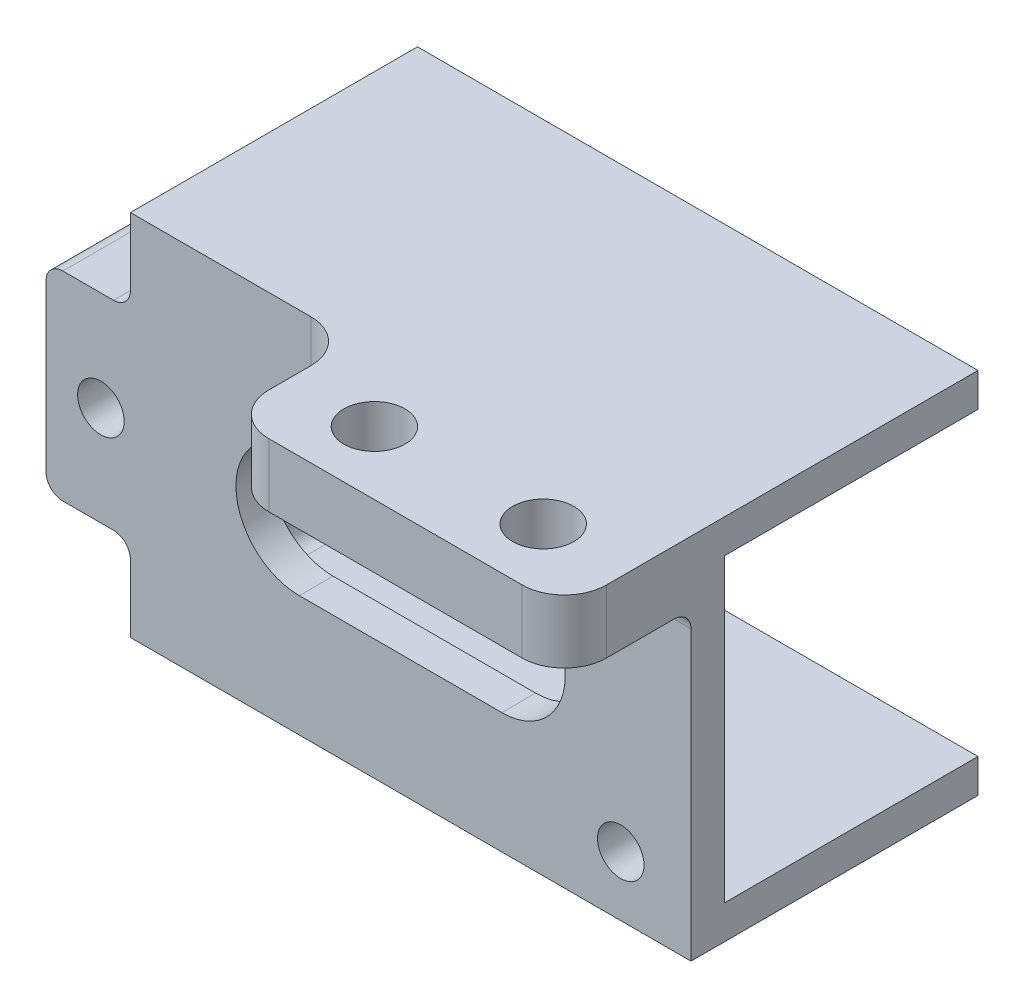
from build123d import *

# Parameters (mm, degrees)
BOSS_EXTRUDE1_DEPTH     = 19.05
SKETCH2_W               = 42.164
SKETCH2_H               = 27.686
BOSS_EXTRUDE2_DEPTH     = 2.54
SKETCH3_W               = 7.0612
SKETCH3_H               = 14.986
BOSS_EXTRUDE3_DEPTH     = 6.35
CUT_EXTRUDE1_DEPTH      = 50.127067096
CUT_EXTRUDE1_DEPTH_BACK = 50.127067096
SKETCH4_R               = 1.75
FILLET2_R               = 1.27
CUT_EXTRUDE2_DEPTH      = 52.65763053
CUT_EXTRUDE2_DEPTH_BACK = 52.65763053
SKETCH5_R               = 4.7625
SKETCH6_W               = 25.4
SKETCH6_H               = 4.7625
BOSS_EXTRUDE4_DEPTH     = 9.525
FILLET3_R               = 3.175
FILLET4_R               = 1.27
FILLET6_R               = 1.27
CUT_EXTRUDE3_DEPTH      = 58.486687197
CUT_EXTRUDE3_DEPTH_BACK = 58.486687197
SKETCH8_R               = 2.3
SKETCH9_W               = 2.54
SKETCH9_H               = 10.16
CUT_EXTRUDE4_DEPTH      = 14.5288
CUT_EXTRUDE5_DEPTH      = 51.648644651
CUT_EXTRUDE5_DEPTH_BACK = 51.648644651
SKETCH10_R              = 1.7499965


with BuildPart() as part:
    # Sketch1 → Boss-Extrude1 (new body)
    with BuildSketch(Plane.XY):
        Polygon((-2.54, 25.146), (39.624, 25.146), (39.624, 22.606), (37.084, 22.606), (0, 22.606), (0, 0), (37.084, 0), (39.624, 0), (39.624, -2.54), (-2.54, -2.54), align=None)
    extrude(amount=BOSS_EXTRUDE1_DEPTH)

    # Sketch2 → Boss-Extrude2 (add)
    with BuildSketch(Plane.XY.offset(19.05)):
        with Locations((18.542, 11.303)):
            Rectangle(SKETCH2_W, SKETCH2_H)
    extrude(amount=BOSS_EXTRUDE2_DEPTH)

    # Sketch3 → Boss-Extrude3 (add)
    with BuildSketch(Plane.ZY.offset(2.54)):
        with Locations((18.0594, 11.303)):
            Rectangle(SKETCH3_W, SKETCH3_H)
    extrude(amount=BOSS_EXTRUDE3_DEPTH)

    # Sketch4 → Cut-Extrude1 (cut, two sides: drawn at the far end of the back side and taken through both)
    with BuildSketch(Plane(origin=(0, 0, 14.5288), x_dir=(-1, 0, 0), z_dir=(0, 0, -1)).offset(-CUT_EXTRUDE1_DEPTH_BACK)):
        with Locations(Location((4.7625, 11.303, 0), (0, 0, 90))):
            Circle(SKETCH4_R)
    extrude(amount=CUT_EXTRUDE1_DEPTH + CUT_EXTRUDE1_DEPTH_BACK, mode=Mode.SUBTRACT)

    # Fillet2
    fillet2_edges = [part.edges().sort_by_distance(p)[0] for p in [
        (-2.54, 18.796, 18.0594),
        (-2.54, 3.81, 18.0594),
        (-8.89, 18.796, 18.0594),
        (-8.89, 3.81, 18.0594),
    ]]
    fillet(fillet2_edges, radius=FILLET2_R)

    # Sketch5 → Cut-Extrude2 (cut, two sides: drawn at the far end of the back side and taken through both)
    with BuildSketch(Plane.XY.offset(21.59).offset(-CUT_EXTRUDE2_DEPTH_BACK)):
        with Locations((10.16, 11.303)):
            Circle(SKETCH5_R)
        with BuildLine():
            Line((25.4, 16.0655), (10.16, 16.0655))
            ThreePointArc((10.16, 16.0655), (13.527596045, 14.670596045), (14.9225, 11.303))
            ThreePointArc((14.9225, 11.303), (13.527596045, 7.935403955), (10.16, 6.5405))
            Line((10.16, 6.5405), (25.4, 6.5405))
            ThreePointArc((25.4, 6.5405), (20.6375, 11.303), (25.4, 16.0655))
        make_face()
        with Locations((25.4, 11.303)):
            Circle(SKETCH5_R)
    extrude(amount=CUT_EXTRUDE2_DEPTH + CUT_EXTRUDE2_DEPTH_BACK, mode=Mode.SUBTRACT)

    # Sketch6 → Boss-Extrude4 (add)
    with BuildSketch(Plane.XY.offset(21.59)):
        with Locations((26.924, 22.76475)):
            Rectangle(SKETCH6_W, SKETCH6_H)
    extrude(amount=BOSS_EXTRUDE4_DEPTH)

    # Fillet3
    fillet3_edges = [part.edges().sort_by_distance(p)[0] for p in [
        (14.224, 22.76475, 21.59),
        (14.224, 22.76475, 31.115),
        (39.624, 22.76475, 31.115),
    ]]
    fillet(fillet3_edges, radius=FILLET3_R)

    # Fillet4
    fillet4_edges = [part.edges().sort_by_distance(p)[0] for p in [
        (25.3365, 20.3835, 21.59),
    ]]
    fillet(fillet4_edges, radius=FILLET4_R)

    # Fillet6
    fillet6_edges = [part.edges().sort_by_distance(p)[0] for p in [
        (0, 0, 9.525),
        (0, 22.606, 9.525),
    ]]
    fillet(fillet6_edges, radius=FILLET6_R)

    # Sketch8 → Cut-Extrude3 (cut, two sides: drawn at the far end of the back side and taken through both)
    with BuildSketch(Plane(origin=(0, 25.146, 0), x_dir=(1, 0, 0), z_dir=(0, 1, 0)).offset(-CUT_EXTRUDE3_DEPTH_BACK)):
        with Locations(Location((20.574, -26.3525, 0), (0, 0, 270))):
            Circle(SKETCH8_R)
        with Locations(Location((33.274, -26.3525, 0), (0, 0, 270))):
            Circle(SKETCH8_R)
    extrude(amount=CUT_EXTRUDE3_DEPTH + CUT_EXTRUDE3_DEPTH_BACK, mode=Mode.SUBTRACT)

    # Sketch9 → Cut-Extrude4 (cut)
    with BuildSketch(Plane(origin=(0, 0, 0), x_dir=(-1, 0, 0), z_dir=(0, 0, -1))):
        with Locations((1.27, 11.303)):
            Rectangle(SKETCH9_W, SKETCH9_H)
    extrude(amount=-CUT_EXTRUDE4_DEPTH, mode=Mode.SUBTRACT)

    # Sketch10 → Cut-Extrude5 (cut, two sides: drawn at the far end of the back side and taken through both)
    with BuildSketch(Plane(origin=(0, 0, 19.05), x_dir=(-1, 0, 0), z_dir=(0, 0, -1)).offset(-CUT_EXTRUDE5_DEPTH_BACK)):
        with Locations(Location((-34.344, 1.95, 0), (0, 0, 180))):
            Circle(SKETCH10_R)
    extrude(amount=CUT_EXTRUDE5_DEPTH + CUT_EXTRUDE5_DEPTH_BACK, mode=Mode.SUBTRACT)


solid = part.part
